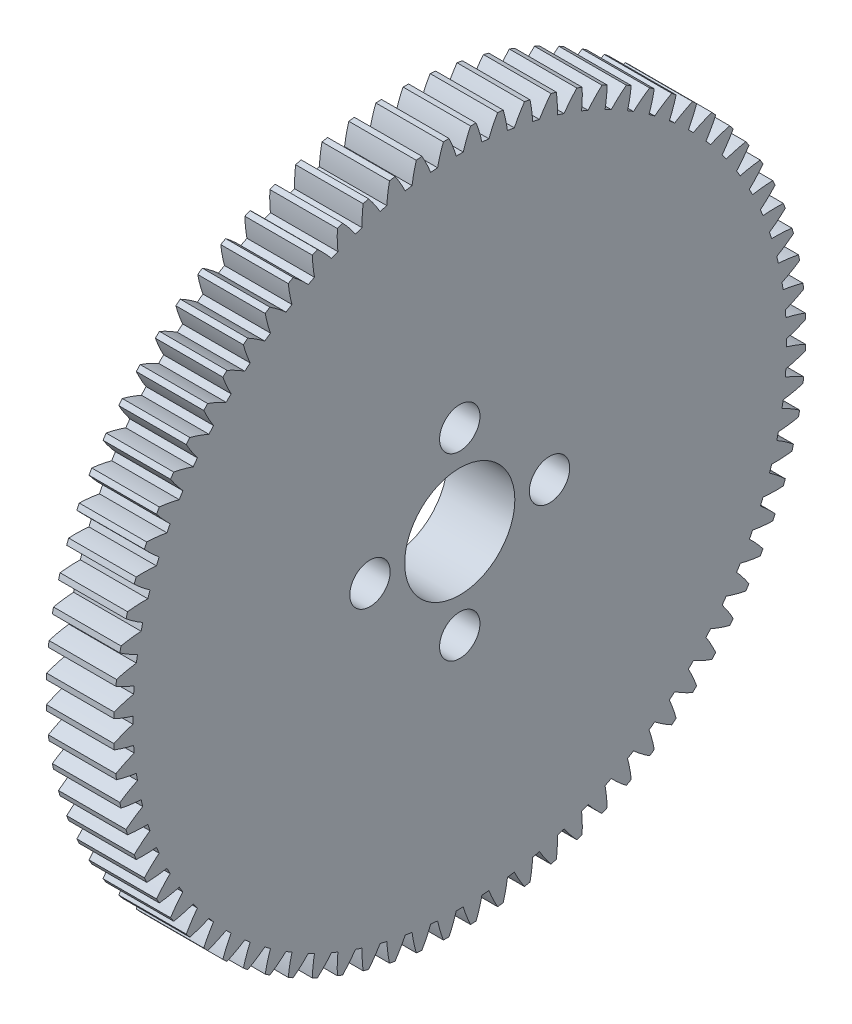
from build123d import *

# Parameters (mm, degrees)
BASPROSKE_W                 = 6.35
BASPROSKE_H                 = 32.54375
TOOTHCUT_DEPTH              = 47.45980874
TEETHCUTS_COUNT             = 80
TEETHCUTS_ANGLE             = 355.5
BORSKE_R                    = 3.175
BORE_DEPTH                  = 50.8000508
SHAFT_AND_SCREW_HOLES_REACH = 48.438
SKETCH1_R                   = 5.1816
SKETCH1_R_2                 = 1.89865


with BuildPart() as part:
    # BasProSke → Base-Revolve (revolve)
    with BuildSketch(Plane(origin=(0, 0, 0), x_dir=(1, 0, 0), z_dir=(0, 1, 0))):
        with Locations((3.175, 16.271875)):
            Rectangle(BASPROSKE_W, BASPROSKE_H)
    revolve(axis=Axis((-10, 0, 0), (1, 0, 0)))

    # TooCutSke → ToothCut (cut, through all)
    with BuildSketch(Plane(origin=(0, 0, 0), x_dir=(0, 0, -1), z_dir=(1, 0, 0))):
        with BuildLine():
            ThreePointArc((0.327817163, 30.744952379), (0, 30.7467), (-0.327817163, 30.744952379))
            ThreePointArc((-0.327817163, 30.744952379), (-0.641780517, 31.66230039), (-1.024813222, 32.553022741))
            ThreePointArc((-1.024813222, 32.553022741), (0, 32.56915), (1.024813222, 32.553022741))
            ThreePointArc((1.024813222, 32.553022741), (0.641780517, 31.66230039), (0.327817163, 30.744952379))
        make_face()
    toothcut = extrude(amount=TOOTHCUT_DEPTH, mode=Mode.SUBTRACT)

    # TeethCuts: ToothCut ×80 about axis
    teethcuts_axis = Axis((-10, 0, 0), (1, 0, 0))
    for i in range(1, TEETHCUTS_COUNT):
        add(toothcut.rotate(teethcuts_axis, i * TEETHCUTS_ANGLE / (TEETHCUTS_COUNT - 1)), mode=Mode.SUBTRACT)

    # BorSke → Bore (cut, symmetric)
    with BuildSketch(Plane(origin=(0, 0, 0), x_dir=(0, 0, -1), z_dir=(1, 0, 0))):
        Circle(BORSKE_R)
    extrude(amount=BORE_DEPTH, both=True, mode=Mode.SUBTRACT)

    # Sketch1 → Shaft and Screw Holes (cut, up to next)
    with BuildSketch(Plane(origin=(6.35, 0, 0), x_dir=(0, 0, -1), z_dir=(1, 0, 0)), mode=Mode.PRIVATE) as shaft_and_screw_holes_sk1:
        Circle(SKETCH1_R)
    shaft_and_screw_holes_tool1 = extrude(shaft_and_screw_holes_sk1.sketch, amount=-SHAFT_AND_SCREW_HOLES_REACH, mode=Mode.PRIVATE) & part.part
    # Sketch1 → Shaft and Screw Holes (cut, up to next)
    with BuildSketch(Plane(origin=(6.35, 0, 0), x_dir=(0, 0, -1), z_dir=(1, 0, 0)), mode=Mode.PRIVATE) as shaft_and_screw_holes_sk2:
        with Locations((-8.446008, 0)):
            Circle(SKETCH1_R_2)
    shaft_and_screw_holes_tool2 = extrude(shaft_and_screw_holes_sk2.sketch, amount=-SHAFT_AND_SCREW_HOLES_REACH, mode=Mode.PRIVATE) & part.part
    # Sketch1 → Shaft and Screw Holes (cut, up to next)
    with BuildSketch(Plane(origin=(6.35, 0, 0), x_dir=(0, 0, -1), z_dir=(1, 0, 0)), mode=Mode.PRIVATE) as shaft_and_screw_holes_sk3:
        with Locations((0, 8.446008)):
            Circle(SKETCH1_R_2)
    shaft_and_screw_holes_tool3 = extrude(shaft_and_screw_holes_sk3.sketch, amount=-SHAFT_AND_SCREW_HOLES_REACH, mode=Mode.PRIVATE) & part.part
    # Sketch1 → Shaft and Screw Holes (cut, up to next)
    with BuildSketch(Plane(origin=(6.35, 0, 0), x_dir=(0, 0, -1), z_dir=(1, 0, 0)), mode=Mode.PRIVATE) as shaft_and_screw_holes_sk4:
        with Locations((8.446008, 0)):
            Circle(SKETCH1_R_2)
    shaft_and_screw_holes_tool4 = extrude(shaft_and_screw_holes_sk4.sketch, amount=-SHAFT_AND_SCREW_HOLES_REACH, mode=Mode.PRIVATE) & part.part
    # Sketch1 → Shaft and Screw Holes (cut, up to next)
    with BuildSketch(Plane(origin=(6.35, 0, 0), x_dir=(0, 0, -1), z_dir=(1, 0, 0)), mode=Mode.PRIVATE) as shaft_and_screw_holes_sk5:
        with Locations((0, -8.446008)):
            Circle(SKETCH1_R_2)
    shaft_and_screw_holes_tool5 = extrude(shaft_and_screw_holes_sk5.sketch, amount=-SHAFT_AND_SCREW_HOLES_REACH, mode=Mode.PRIVATE) & part.part
    add(shaft_and_screw_holes_tool1.solids().sort_by_distance((6.35, 0, 0))[0], mode=Mode.SUBTRACT)
    add(shaft_and_screw_holes_tool2.solids().sort_by_distance((6.35, 0, 8.446008))[0], mode=Mode.SUBTRACT)
    add(shaft_and_screw_holes_tool3.solids().sort_by_distance((6.35, 8.446008, 0))[0], mode=Mode.SUBTRACT)
    add(shaft_and_screw_holes_tool4.solids().sort_by_distance((6.35, 0, -8.446008))[0], mode=Mode.SUBTRACT)
    add(shaft_and_screw_holes_tool5.solids().sort_by_distance((6.35, -8.446008, 0))[0], mode=Mode.SUBTRACT)


solid = part.part
